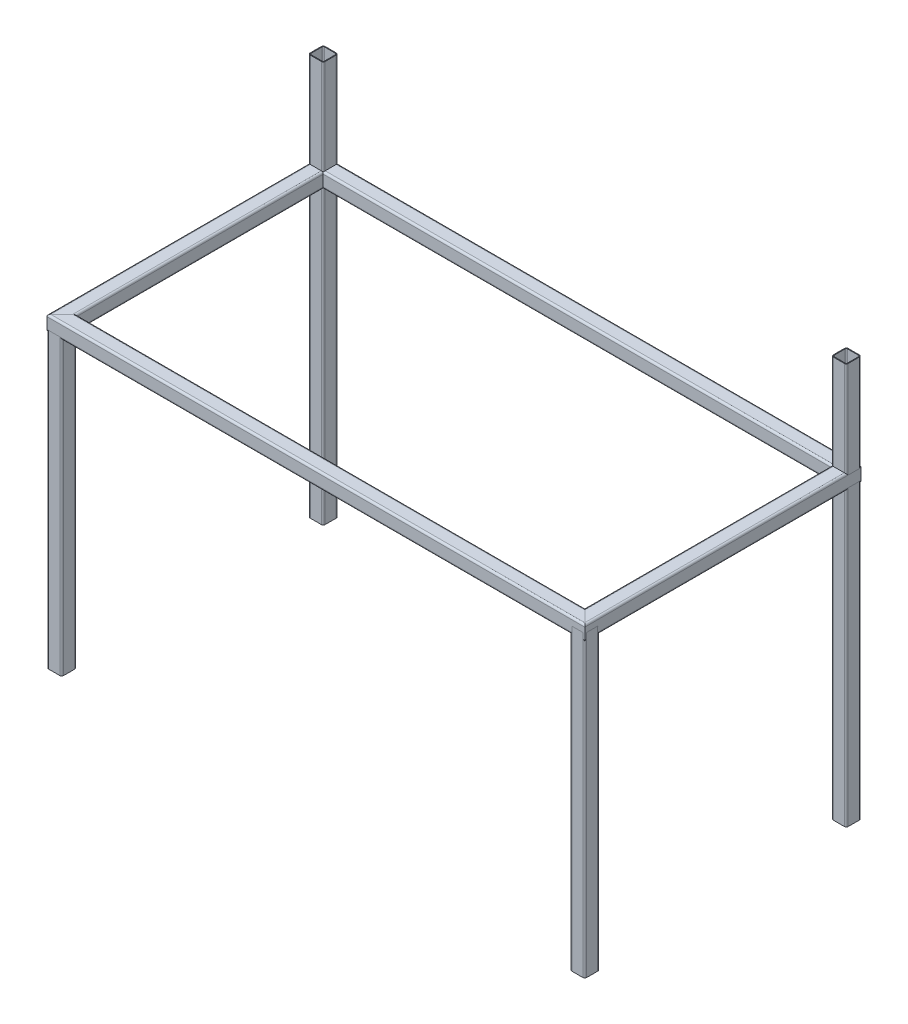
from build123d import *

# Parameters (mm, degrees)
RECTANGULAR_TUBE_CONFIGURED_40_X_40_X_DEPTH      = 1429.284271247
RECTANGULAR_TUBE_CONFIGURED_40_X_40_X_DEPTH_BACK = 29.284271247
RECTANGULAR_TUBE_CONFIGURED_40_X_4_4_DEPTH       = 758.568542495
RECTANGULAR_TUBE_CONFIGURED_40_X_4_6_DEPTH       = 1458.568542495
RECTANGULAR_TUBE_CONFIGURED_40_X_4_8_DEPTH       = 758.568542495
RECTANGULAR_TUBE_CONFIGURED_40_X_4_10_DEPTH      = 1073.458017645
RECTANGULAR_TUBE_CONFIGURED_40_X_4_11_DEPTH      = 1073.458017645
RECTANGULAR_TUBE_CONFIGURED_40_X_4_12_DEPTH      = 800
RECTANGULAR_TUBE_CONFIGURED_40_X_4_13_DEPTH      = 800


with BuildPart() as part:
    # Sketch12 → Rectangular tube - configured 40 X 40 X (new, two sides: drawn at the far end of the back side and taken through both)
    with BuildSketch(Plane(origin=(-700, 800, 350), x_dir=(0, 0, -1), z_dir=(1, 0, 0)).offset(-RECTANGULAR_TUBE_CONFIGURED_40_X_40_X_DEPTH_BACK)):
        with BuildLine():
            Line((-14.8, -20), (14.8, -20))
            ThreePointArc((14.8, -20), (18.476955262, -18.476955262), (20, -14.8))
            Line((20, -14.8), (20, 14.8))
            ThreePointArc((20, 14.8), (18.476955262, 18.476955262), (14.8, 20))
            Line((14.8, 20), (-14.8, 20))
            ThreePointArc((-14.8, 20), (-18.476955262, 18.476955262), (-20, 14.8))
            Line((-20, 14.8), (-20, -14.8))
            ThreePointArc((-20, -14.8), (-18.476955262, -18.476955262), (-14.8, -20))
        make_face()
        with BuildLine():
            Line((-14.8, -18), (14.8, -18))
            ThreePointArc((14.8, -18), (17.0627417, -17.0627417), (18, -14.8))
            Line((18, -14.8), (18, 14.8))
            ThreePointArc((18, 14.8), (17.0627417, 17.0627417), (14.8, 18))
            Line((14.8, 18), (-14.8, 18))
            ThreePointArc((-14.8, 18), (-17.0627417, 17.0627417), (-18, 14.8))
            Line((-18, 14.8), (-18, -14.8))
            ThreePointArc((-18, -14.8), (-17.0627417, -17.0627417), (-14.8, -18))
        make_face(mode=Mode.SUBTRACT)
    extrude(amount=RECTANGULAR_TUBE_CONFIGURED_40_X_40_X_DEPTH + RECTANGULAR_TUBE_CONFIGURED_40_X_40_X_DEPTH_BACK)

    # Rectangular tube - configured 40 X 4 2
    split(bisect_by=Plane(origin=(-700, 800, 350), x_dir=(0, 1, 0), z_dir=(0.707106781, 0, 0.707106781)), keep=Keep.TOP)

    # Rectangular tube - configured 40 X 4 3
    split(bisect_by=Plane(origin=(700, 800, 350), x_dir=(0, -1, 0), z_dir=(-0.707106781, 0, 0.707106781)), keep=Keep.TOP)


with BuildPart() as body_2:
    # Sketch12 on segment 2 (carried to segment 2) → Rectangular tube - configured 40 X 4 4 (new body)
    with BuildSketch(Plane(origin=(700, 800, 379.284271247), x_dir=(-1, 0, 0), z_dir=(0, 0, -1))):
        with BuildLine():
            Line((-14.8, -20), (14.8, -20))
            ThreePointArc((14.8, -20), (18.476955262, -18.476955262), (20, -14.8))
            Line((20, -14.8), (20, 14.8))
            ThreePointArc((20, 14.8), (18.476955262, 18.476955262), (14.8, 20))
            Line((14.8, 20), (-14.8, 20))
            ThreePointArc((-14.8, 20), (-18.476955262, 18.476955262), (-20, 14.8))
            Line((-20, 14.8), (-20, -14.8))
            ThreePointArc((-20, -14.8), (-18.476955262, -18.476955262), (-14.8, -20))
        make_face()
        with BuildLine():
            Line((-14.8, -18), (14.8, -18))
            ThreePointArc((14.8, -18), (17.0627417, -17.0627417), (18, -14.8))
            Line((18, -14.8), (18, 14.8))
            ThreePointArc((18, 14.8), (17.0627417, 17.0627417), (14.8, 18))
            Line((14.8, 18), (-14.8, 18))
            ThreePointArc((-14.8, 18), (-17.0627417, 17.0627417), (-18, 14.8))
            Line((-18, 14.8), (-18, -14.8))
            ThreePointArc((-18, -14.8), (-17.0627417, -17.0627417), (-14.8, -18))
        make_face(mode=Mode.SUBTRACT)
    extrude(amount=RECTANGULAR_TUBE_CONFIGURED_40_X_4_4_DEPTH)

    # Rectangular tube - configured 40 X 4 4 m
    split(bisect_by=Plane(origin=(700, 800, 350), x_dir=(0, 1, 0), z_dir=(0.707106781, 0, -0.707106781)), keep=Keep.TOP)

    # Rectangular tube - configured 40 X 4 5
    split(bisect_by=Plane(origin=(700, 800, -350), x_dir=(0, 1, 0), z_dir=(0.707106781, 0, 0.707106781)), keep=Keep.TOP)


with BuildPart() as body_3:
    # Sketch12 on segment 3 (carried to segment 3) → Rectangular tube - configured 40 X 4 6 (new body)
    with BuildSketch(Plane(origin=(729.284271247, 800, -350), x_dir=(0, 0, 1), z_dir=(-1, 0, 0))):
        with BuildLine():
            Line((-14.8, -20), (14.8, -20))
            ThreePointArc((14.8, -20), (18.476955262, -18.476955262), (20, -14.8))
            Line((20, -14.8), (20, 14.8))
            ThreePointArc((20, 14.8), (18.476955262, 18.476955262), (14.8, 20))
            Line((14.8, 20), (-14.8, 20))
            ThreePointArc((-14.8, 20), (-18.476955262, 18.476955262), (-20, 14.8))
            Line((-20, 14.8), (-20, -14.8))
            ThreePointArc((-20, -14.8), (-18.476955262, -18.476955262), (-14.8, -20))
        make_face()
        with BuildLine():
            Line((-14.8, -18), (14.8, -18))
            ThreePointArc((14.8, -18), (17.0627417, -17.0627417), (18, -14.8))
            Line((18, -14.8), (18, 14.8))
            ThreePointArc((18, 14.8), (17.0627417, 17.0627417), (14.8, 18))
            Line((14.8, 18), (-14.8, 18))
            ThreePointArc((-14.8, 18), (-17.0627417, 17.0627417), (-18, 14.8))
            Line((-18, 14.8), (-18, -14.8))
            ThreePointArc((-18, -14.8), (-17.0627417, -17.0627417), (-14.8, -18))
        make_face(mode=Mode.SUBTRACT)
    extrude(amount=RECTANGULAR_TUBE_CONFIGURED_40_X_4_6_DEPTH)

    # Rectangular tube - configured 40 X 4 6 m
    split(bisect_by=Plane(origin=(700, 800, -350), x_dir=(0, -1, 0), z_dir=(-0.707106781, 0, -0.707106781)), keep=Keep.TOP)

    # Rectangular tube - configured 40 X 4 7
    split(bisect_by=Plane(origin=(-700, 800, -350), x_dir=(0, 1, 0), z_dir=(0.707106781, 0, -0.707106781)), keep=Keep.TOP)


with BuildPart() as body_4:
    # Sketch12 on segment 4 (carried to segment 4) → Rectangular tube - configured 40 X 4 8 (new body)
    with BuildSketch(Plane(origin=(-700, 800, -379.284271247), x_dir=(1, 0, 0), z_dir=(0, 0, 1))):
        with BuildLine():
            Line((-14.8, -20), (14.8, -20))
            ThreePointArc((14.8, -20), (18.476955262, -18.476955262), (20, -14.8))
            Line((20, -14.8), (20, 14.8))
            ThreePointArc((20, 14.8), (18.476955262, 18.476955262), (14.8, 20))
            Line((14.8, 20), (-14.8, 20))
            ThreePointArc((-14.8, 20), (-18.476955262, 18.476955262), (-20, 14.8))
            Line((-20, 14.8), (-20, -14.8))
            ThreePointArc((-20, -14.8), (-18.476955262, -18.476955262), (-14.8, -20))
        make_face()
        with BuildLine():
            Line((-14.8, -18), (14.8, -18))
            ThreePointArc((14.8, -18), (17.0627417, -17.0627417), (18, -14.8))
            Line((18, -14.8), (18, 14.8))
            ThreePointArc((18, 14.8), (17.0627417, 17.0627417), (14.8, 18))
            Line((14.8, 18), (-14.8, 18))
            ThreePointArc((-14.8, 18), (-17.0627417, 17.0627417), (-18, 14.8))
            Line((-18, 14.8), (-18, -14.8))
            ThreePointArc((-18, -14.8), (-17.0627417, -17.0627417), (-14.8, -18))
        make_face(mode=Mode.SUBTRACT)
    extrude(amount=RECTANGULAR_TUBE_CONFIGURED_40_X_4_8_DEPTH)

    # Rectangular tube - configured 40 X 4 8 m
    split(bisect_by=Plane(origin=(-700, 800, -350), x_dir=(0, -1, 0), z_dir=(-0.707106781, 0, 0.707106781)), keep=Keep.TOP)

    # Rectangular tube - configured 40 X 4 9
    split(bisect_by=Plane(origin=(-700, 800, 350), x_dir=(0, -1, 0), z_dir=(-0.707106781, 0, -0.707106781)), keep=Keep.TOP)


with BuildPart() as body_5:
    # Sketch1 → Rectangular tube - configured 40 X 4 10 (new body)
    with BuildSketch(Plane(origin=(-700, 1073.458017645, -350), x_dir=(1, 0, 0), z_dir=(0, -1, 0))):
        with BuildLine():
            Line((-14.8, -20), (14.8, -20))
            ThreePointArc((14.8, -20), (18.476955262, -18.476955262), (20, -14.8))
            Line((20, -14.8), (20, 14.8))
            ThreePointArc((20, 14.8), (18.476955262, 18.476955262), (14.8, 20))
            Line((14.8, 20), (-14.8, 20))
            ThreePointArc((-14.8, 20), (-18.476955262, 18.476955262), (-20, 14.8))
            Line((-20, 14.8), (-20, -14.8))
            ThreePointArc((-20, -14.8), (-18.476955262, -18.476955262), (-14.8, -20))
        make_face()
        with BuildLine():
            Line((-14.8, -18), (14.8, -18))
            ThreePointArc((14.8, -18), (17.0627417, -17.0627417), (18, -14.8))
            Line((18, -14.8), (18, 14.8))
            ThreePointArc((18, 14.8), (17.0627417, 17.0627417), (14.8, 18))
            Line((14.8, 18), (-14.8, 18))
            ThreePointArc((-14.8, 18), (-17.0627417, 17.0627417), (-18, 14.8))
            Line((-18, 14.8), (-18, -14.8))
            ThreePointArc((-18, -14.8), (-17.0627417, -17.0627417), (-14.8, -18))
        make_face(mode=Mode.SUBTRACT)
    extrude(amount=RECTANGULAR_TUBE_CONFIGURED_40_X_4_10_DEPTH)


with BuildPart() as body_6:
    # Sketch1 on segment 2 (carried to segment 2) → Rectangular tube - configured 40 X 4 11 (new body)
    with BuildSketch(Plane(origin=(700, 1073.458017645, -350), x_dir=(1, 0, 0), z_dir=(0, -1, 0))):
        with BuildLine():
            Line((-14.8, -20), (14.8, -20))
            ThreePointArc((14.8, -20), (18.476955262, -18.476955262), (20, -14.8))
            Line((20, -14.8), (20, 14.8))
            ThreePointArc((20, 14.8), (18.476955262, 18.476955262), (14.8, 20))
            Line((14.8, 20), (-14.8, 20))
            ThreePointArc((-14.8, 20), (-18.476955262, 18.476955262), (-20, 14.8))
            Line((-20, 14.8), (-20, -14.8))
            ThreePointArc((-20, -14.8), (-18.476955262, -18.476955262), (-14.8, -20))
        make_face()
        with BuildLine():
            Line((-14.8, -18), (14.8, -18))
            ThreePointArc((14.8, -18), (17.0627417, -17.0627417), (18, -14.8))
            Line((18, -14.8), (18, 14.8))
            ThreePointArc((18, 14.8), (17.0627417, 17.0627417), (14.8, 18))
            Line((14.8, 18), (-14.8, 18))
            ThreePointArc((-14.8, 18), (-17.0627417, 17.0627417), (-18, 14.8))
            Line((-18, 14.8), (-18, -14.8))
            ThreePointArc((-18, -14.8), (-17.0627417, -17.0627417), (-14.8, -18))
        make_face(mode=Mode.SUBTRACT)
    extrude(amount=RECTANGULAR_TUBE_CONFIGURED_40_X_4_11_DEPTH)


with BuildPart() as body_7:
    # Sketch1 on segment 3 (carried to segment 3) → Rectangular tube - configured 40 X 4 12 (new body)
    with BuildSketch(Plane(origin=(-700, 800, 350), x_dir=(1, 0, 0), z_dir=(0, -1, 0))):
        with BuildLine():
            Line((-14.8, -20), (14.8, -20))
            ThreePointArc((14.8, -20), (18.476955262, -18.476955262), (20, -14.8))
            Line((20, -14.8), (20, 14.8))
            ThreePointArc((20, 14.8), (18.476955262, 18.476955262), (14.8, 20))
            Line((14.8, 20), (-14.8, 20))
            ThreePointArc((-14.8, 20), (-18.476955262, 18.476955262), (-20, 14.8))
            Line((-20, 14.8), (-20, -14.8))
            ThreePointArc((-20, -14.8), (-18.476955262, -18.476955262), (-14.8, -20))
        make_face()
        with BuildLine():
            Line((-14.8, -18), (14.8, -18))
            ThreePointArc((14.8, -18), (17.0627417, -17.0627417), (18, -14.8))
            Line((18, -14.8), (18, 14.8))
            ThreePointArc((18, 14.8), (17.0627417, 17.0627417), (14.8, 18))
            Line((14.8, 18), (-14.8, 18))
            ThreePointArc((-14.8, 18), (-17.0627417, 17.0627417), (-18, 14.8))
            Line((-18, 14.8), (-18, -14.8))
            ThreePointArc((-18, -14.8), (-17.0627417, -17.0627417), (-14.8, -18))
        make_face(mode=Mode.SUBTRACT)
    extrude(amount=RECTANGULAR_TUBE_CONFIGURED_40_X_4_12_DEPTH)


with BuildPart() as body_8:
    # Sketch1 on segment 4 (carried to segment 4) → Rectangular tube - configured 40 X 4 13 (new body)
    with BuildSketch(Plane(origin=(700, 800, 350), x_dir=(1, 0, 0), z_dir=(0, -1, 0))):
        with BuildLine():
            Line((-14.8, -20), (14.8, -20))
            ThreePointArc((14.8, -20), (18.476955262, -18.476955262), (20, -14.8))
            Line((20, -14.8), (20, 14.8))
            ThreePointArc((20, 14.8), (18.476955262, 18.476955262), (14.8, 20))
            Line((14.8, 20), (-14.8, 20))
            ThreePointArc((-14.8, 20), (-18.476955262, 18.476955262), (-20, 14.8))
            Line((-20, 14.8), (-20, -14.8))
            ThreePointArc((-20, -14.8), (-18.476955262, -18.476955262), (-14.8, -20))
        make_face()
        with BuildLine():
            Line((-14.8, -18), (14.8, -18))
            ThreePointArc((14.8, -18), (17.0627417, -17.0627417), (18, -14.8))
            Line((18, -14.8), (18, 14.8))
            ThreePointArc((18, 14.8), (17.0627417, 17.0627417), (14.8, 18))
            Line((14.8, 18), (-14.8, 18))
            ThreePointArc((-14.8, 18), (-17.0627417, 17.0627417), (-18, 14.8))
            Line((-18, 14.8), (-18, -14.8))
            ThreePointArc((-18, -14.8), (-17.0627417, -17.0627417), (-14.8, -18))
        make_face(mode=Mode.SUBTRACT)
    extrude(amount=RECTANGULAR_TUBE_CONFIGURED_40_X_4_13_DEPTH)


solid = Compound([part.part, body_2.part, body_3.part, body_4.part, body_5.part, body_6.part, body_7.part, body_8.part])
